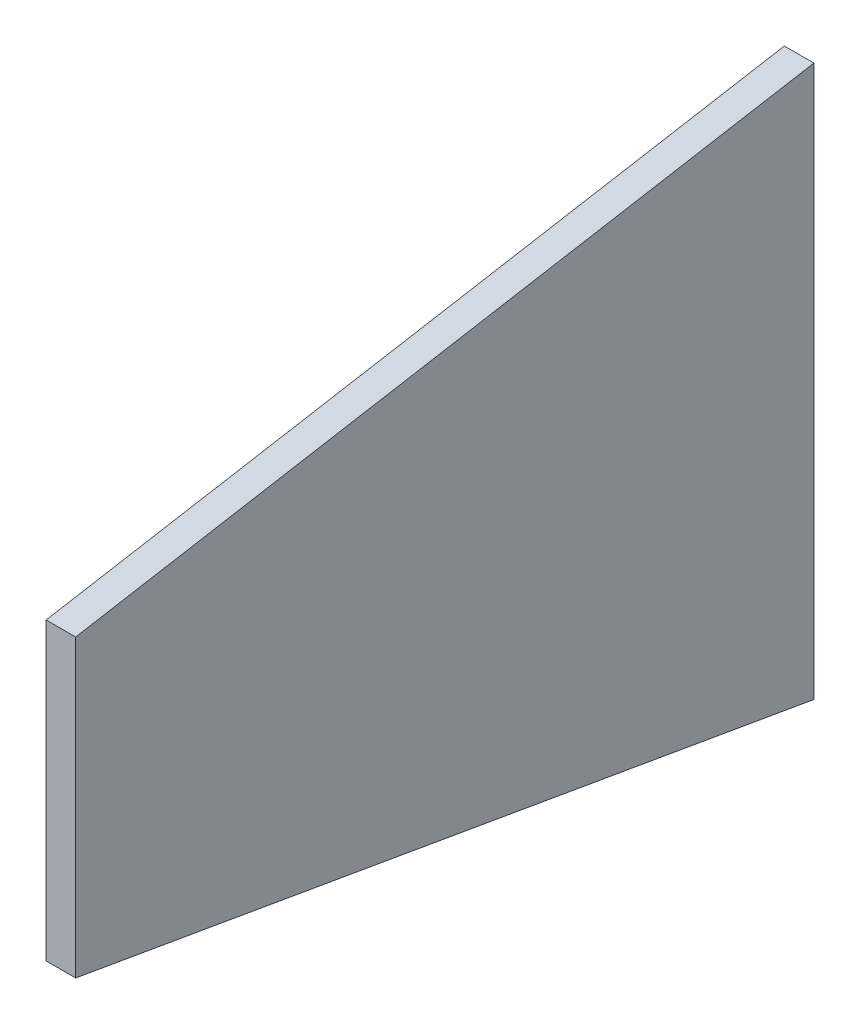
from build123d import *

# Parameters (mm, degrees)
BOSS_EXTRUDE1_DEPTH = 3


with BuildPart() as part:
    # Sketch1 → Boss-Extrude1 (new body)
    with BuildSketch(Plane.YZ):
        Polygon((0, 0), (56, 0), (43, 75), (13, 75), align=None)
    extrude(amount=BOSS_EXTRUDE1_DEPTH)


solid = part.part
